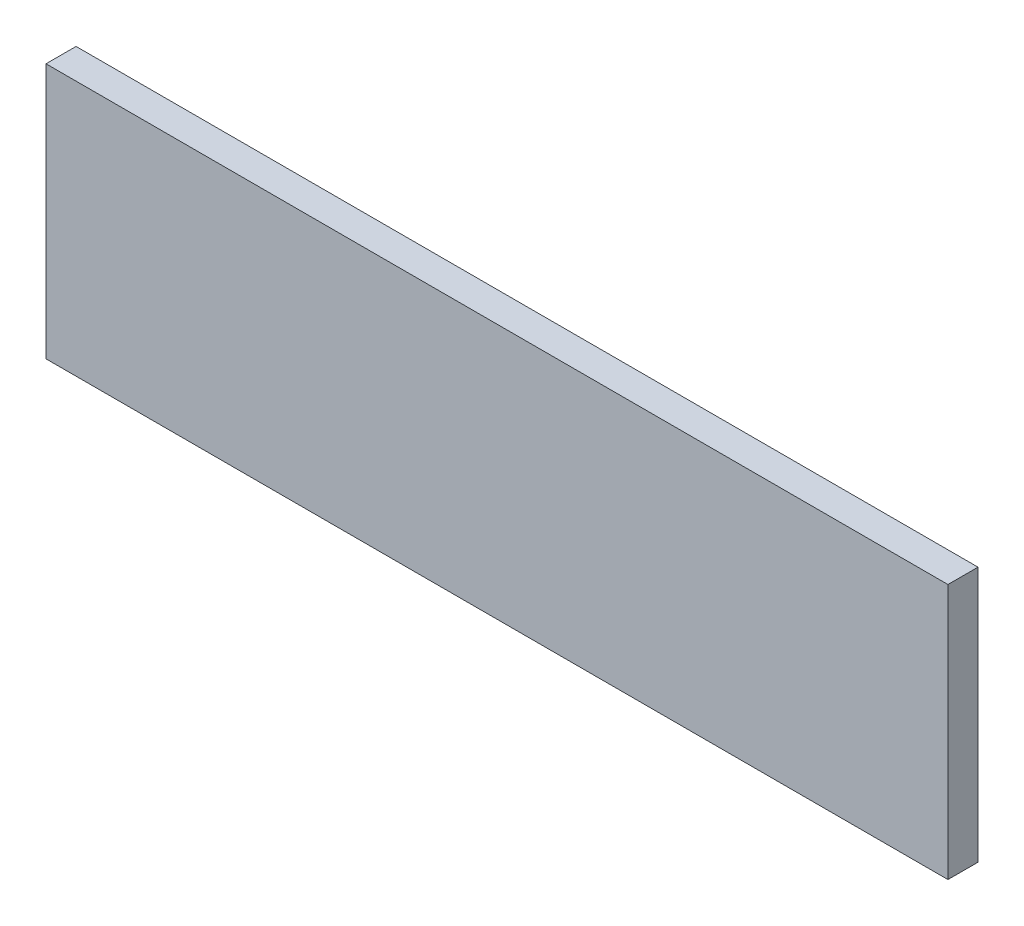
from build123d import *

# Parameters (mm, degrees)
ESQUISSE1_W        = 150
ESQUISSE1_H        = 42.5
BOSS_EXTRU_1_DEPTH = 5


with BuildPart() as part:
    # Esquisse1 → Boss.-Extru.1 (new body)
    with BuildSketch(Plane.XY):
        with Locations((38.833729247, 1.082802548)):
            Rectangle(ESQUISSE1_W, ESQUISSE1_H)
    extrude(amount=BOSS_EXTRU_1_DEPTH)


solid = part.part
